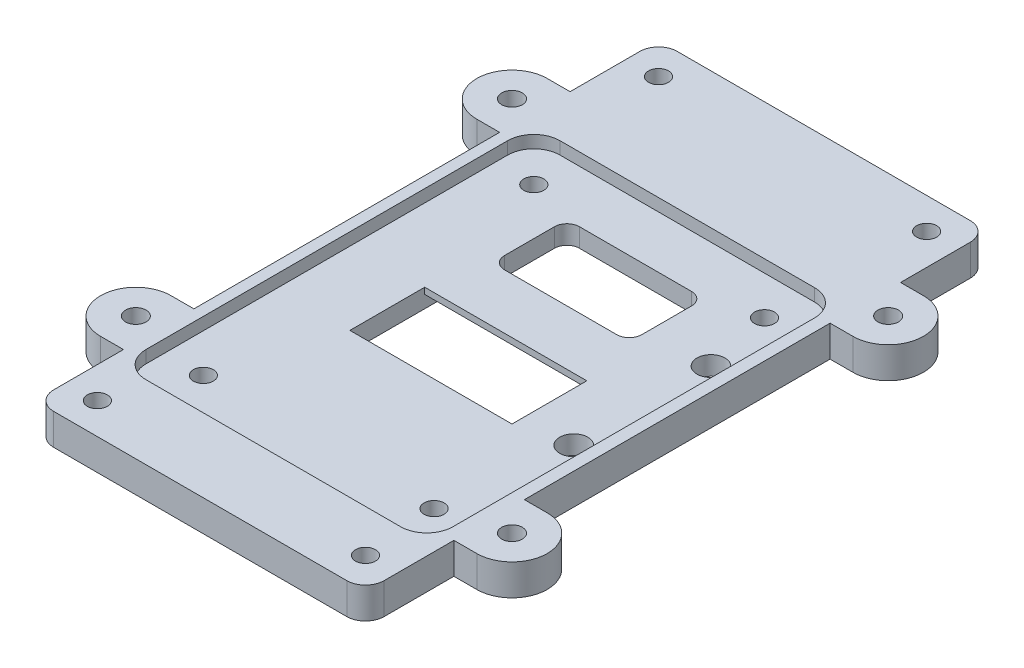
from build123d import *

# Parameters (mm, degrees)
SKETCH1_W           = 47
SKETCH1_H           = 64
BOSS_EXTRUDE1_DEPTH = 5
SKETCH2_W           = 22
SKETCH2_H           = 12
SKETCH2_W_2         = 26
CUT_EXTRUDE1_DEPTH  = 5
SKETCH3_R           = 1.6
CUT_EXTRUDE2_DEPTH  = 63
FILLET1_R           = 2
FILLET2_R           = 3
SKETCH5_R           = 1.65
BOSS_EXTRUDE3_DEPTH = 5
CUT_EXTRUDE5_DEPTH  = 2
SKETCH7_R           = 1.6
CUT_EXTRUDE7_DEPTH  = 66.823356227
CHAMFER4_SIZE       = 2
FILLET3_R           = 3
SKETCH8_R           = 2.25
CUT_EXTRUDE8_DEPTH  = 66.823356227


with BuildPart() as part:
    # Sketch1 → Boss-Extrude1 (new body)
    with BuildSketch(Plane(origin=(0, 0, 0), x_dir=(1, 0, 0), z_dir=(0, 1, 0))):
        Rectangle(SKETCH1_W, SKETCH1_H)
    extrude(amount=BOSS_EXTRUDE1_DEPTH)

    # Sketch2 → Cut-Extrude1 (cut)
    with BuildSketch(Plane(origin=(0, 5, 0), x_dir=(1, 0, 0), z_dir=(0, 1, 0))):
        with Locations((0, 18.81)):
            Rectangle(SKETCH2_W, SKETCH2_H)
        with Locations((0, -2)):
            Rectangle(SKETCH2_W_2, SKETCH2_H)
    extrude(amount=-CUT_EXTRUDE1_DEPTH, mode=Mode.SUBTRACT)

    # Sketch3 → Cut-Extrude2 (cut)
    with BuildSketch(Plane(origin=(0, 5, 0), x_dir=(1, 0, 0), z_dir=(0, 1, 0))):
        with Locations(Location((-18.5, 27, 0), (0, 0, 270))):
            Circle(SKETCH3_R)
        with Locations(Location((18.5, 27, 0), (0, 0, 90))):
            Circle(SKETCH3_R)
        with Locations(Location((-18.5, -26, 0), (0, 0, 270))):
            Circle(SKETCH3_R)
        with Locations(Location((18.5, -26, 0), (0, 0, 90))):
            Circle(SKETCH3_R)
    extrude(amount=-CUT_EXTRUDE2_DEPTH, mode=Mode.SUBTRACT)

    # Fillet1
    fillet1_edges = [part.edges().sort_by_distance(p)[0] for p in [
        (11, 2.5, -12.81),
        (-11, 2.5, -12.81),
        (-11, 2.5, -24.81),
        (11, 2.5, -24.81),
    ]]
    fillet(fillet1_edges, radius=FILLET1_R)

    # Fillet2
    fillet2_edges = [part.edges().sort_by_distance(p)[0] for p in [
        (23.5, 2.5, -32),
        (23.5, 2.5, 32),
        (-23.5, 2.5, 32),
        (-23.5, 2.5, -32),
    ]]
    fillet(fillet2_edges, radius=FILLET2_R)

    # Sketch5 → Boss-Extrude3 (add)
    with BuildSketch(Plane(origin=(0, 5, 0), x_dir=(1, 0, 0), z_dir=(0, 1, 0))):
        with BuildLine():
            ThreePointArc((-30.165, 40.815), (-35.815, 35.165), (-30.165, 29.515))
            Line((-30.165, 29.515), (-26.5, 29.515))
            Line((-26.5, 29.515), (-26.5, -19.515))
            Line((-26.5, -19.515), (-30.165, -19.515))
            ThreePointArc((-30.165, -19.515), (-35.815, -25.165), (-30.165, -30.815))
            Line((-30.165, -30.815), (-26.5, -30.815))
            Line((-26.5, -30.815), (-26.5, -45))
            Line((-26.5, -45), (26.5, -45))
            Line((26.5, -45), (26.5, -30.815))
            Line((26.5, -30.815), (30.165, -30.815))
            ThreePointArc((30.165, -30.815), (35.815, -25.165), (30.165, -19.515))
            Line((30.165, -19.515), (26.5, -19.515))
            Line((26.5, -19.515), (26.5, 29.515))
            Line((26.5, 29.515), (30.165, 29.515))
            ThreePointArc((30.165, 29.515), (35.815, 35.165), (30.165, 40.815))
            Line((30.165, 40.815), (26.5, 40.815))
            Line((26.5, 40.815), (26.5, 55))
            Line((26.5, 55), (-26.5, 55))
            Line((-26.5, 55), (-26.5, 40.815))
            Line((-26.5, 40.815), (-30.165, 40.815))
        make_face()
        with Locations(Location((-30.165, -25.165, 0), (0, 0, 270))):
            Circle(SKETCH5_R, mode=Mode.SUBTRACT)
        with BuildLine():
            ThreePointArc((-20.5, -32), (-22.621320344, -31.121320344), (-23.5, -29))
            Line((-23.5, -29), (-23.5, 29))
            ThreePointArc((-23.5, 29), (-22.621320344, 31.121320344), (-20.5, 32))
            Line((-20.5, 32), (20.5, 32))
            ThreePointArc((20.5, 32), (22.621320344, 31.121320344), (23.5, 29))
            Line((23.5, 29), (23.5, -25.165))
            Line((23.5, -25.165), (23.5, -29))
            ThreePointArc((23.5, -29), (22.621320344, -31.121320344), (20.5, -32))
            Line((20.5, -32), (-20.5, -32))
        make_face(mode=Mode.SUBTRACT)
        with Locations(Location((30.165, -25.165, 0), (0, 0, 270))):
            Circle(SKETCH5_R, mode=Mode.SUBTRACT)
        with Locations(Location((-30.165, 35.165, 0), (0, 0, 270))):
            Circle(SKETCH5_R, mode=Mode.SUBTRACT)
        with BuildLine():
            ThreePointArc((28.998273811, 33.998273811), (30.796427663, 36.689401229), (30.165, 33.515))
            ThreePointArc((30.165, 33.515), (29.533572337, 33.640598771), (28.998273811, 33.998273811))
        make_face(mode=Mode.SUBTRACT)
    extrude(amount=-BOSS_EXTRUDE3_DEPTH)

    # Sketch6 → Cut-Extrude5 (cut)
    with BuildSketch(Plane(origin=(0, 5, 0), x_dir=(1, 0, 0), z_dir=(0, 1, 0))):
        with BuildLine():
            Line((-24.7, 29), (-24.7, -29))
            ThreePointArc((-24.7, -29), (-23.469848481, -31.969848481), (-20.5, -33.2))
            Line((-20.5, -33.2), (20.331389121, -33.2))
            ThreePointArc((20.331389121, -33.2), (23.301237602, -31.969848481), (24.531389121, -29))
            Line((24.531389121, -29), (24.531389121, 29))
            ThreePointArc((24.531389121, 29), (23.301237602, 31.969848481), (20.331389121, 33.2))
            Line((20.331389121, 33.2), (-20.5, 33.2))
            ThreePointArc((-20.5, 33.2), (-23.469848481, 31.969848481), (-24.7, 29))
        make_face()
    extrude(amount=-CUT_EXTRUDE5_DEPTH, mode=Mode.SUBTRACT)

    # Sketch7 → Cut-Extrude7 (cut, through all)
    with BuildSketch(Plane.XZ):
        with Locations(Location((-21.5, 40, 0), (0, 0, 270))):
            Circle(SKETCH7_R)
        with Locations(Location((21.5, 40, 0), (0, 0, 90))):
            Circle(SKETCH7_R)
        with Locations(Location((-21.5, -50, 0), (0, 0, 270))):
            Circle(SKETCH7_R)
        with Locations(Location((21.5, -50, 0), (0, 0, 90))):
            Circle(SKETCH7_R)
    extrude(amount=-CUT_EXTRUDE7_DEPTH, mode=Mode.SUBTRACT)

    # Chamfer4
    chamfer4_edges = [part.edges().sort_by_distance(p)[0] for p in [
        (0, 0, -4),
        (0, 0, 8),
    ]]
    chamfer(chamfer4_edges, length=CHAMFER4_SIZE)

    # Fillet3
    fillet3_edges = [part.edges().sort_by_distance(p)[0] for p in [
        (26.5, 2.5, -55),
        (-26.5, 2.5, -55),
        (-26.5, 2.5, 45),
        (26.5, 2.5, 45),
    ]]
    fillet(fillet3_edges, radius=FILLET3_R)

    # Sketch8 → Cut-Extrude8 (cut, through all)
    with BuildSketch(Plane.XZ):
        with Locations(Location((20.90630532, -16, 0), (0, 0, 270))):
            Circle(SKETCH8_R)
        with Locations(Location((20.90630532, 6, 0), (0, 0, 270))):
            Circle(SKETCH8_R)
    extrude(amount=-CUT_EXTRUDE8_DEPTH, mode=Mode.SUBTRACT)


solid = part.part
